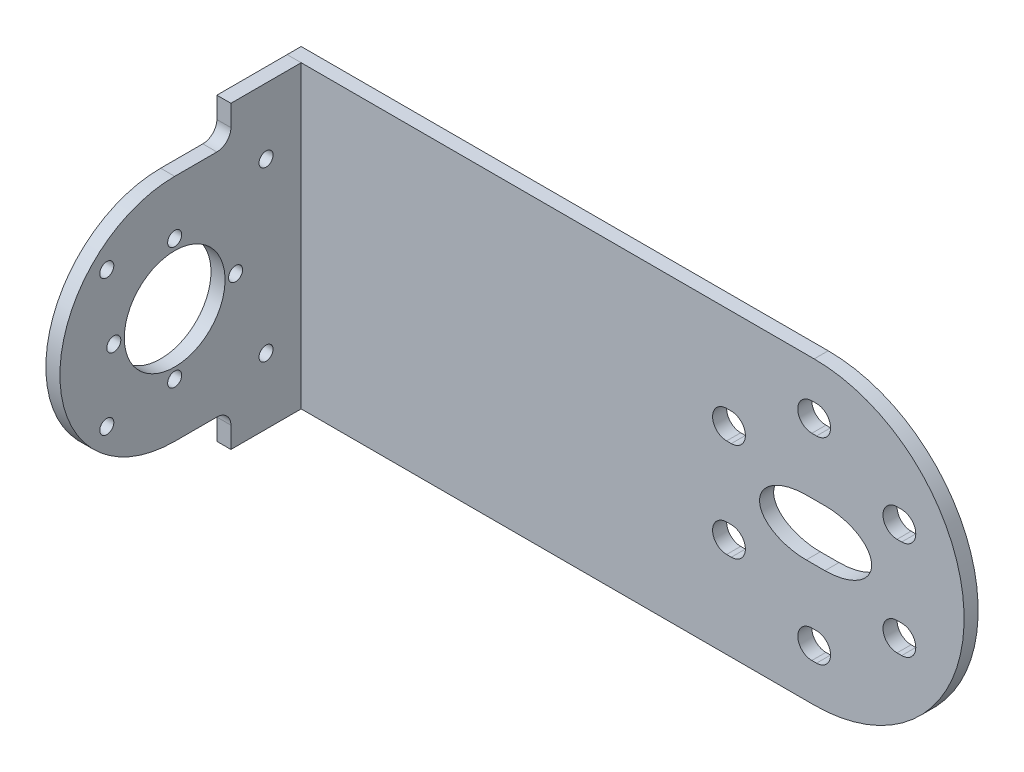
from build123d import *

# Parameters (mm, degrees)
BOSS_EXTRUDE1_DEPTH = 3
SKETCH2_R           = 1.5
BOSS_EXTRUDE2_DEPTH = 3
SKETCH3_R           = 6
CUT_EXTRUDE1_DEPTH  = 150.495916109
CUT_EXTRUDE2_DEPTH  = 128.79866979


with BuildPart() as part:
    # Sketch1 → Boss-Extrude1 (new body)
    with BuildSketch(Plane.XY):
        with BuildLine():
            Line((-112.5, 32), (0, 32))
            ThreePointArc((0, 32), (32, 0), (0, -32))
            Line((0, -32), (-112.5, -32))
            Line((-112.5, -32), (-112.5, 32))
        make_face()
        with BuildLine():
            Line((17.686533479, 13.5), (18.686533479, 13.5))
            ThreePointArc((18.686533479, 13.5), (21.686533479, 10.5), (18.686533479, 7.5))
            Line((18.686533479, 7.5), (17.686533479, 7.5))
            ThreePointArc((17.686533479, 7.5), (14.686533479, 10.5), (17.686533479, 13.5))
        make_face(mode=Mode.SUBTRACT)
        with BuildLine():
            Line((17.686533479, -7.5), (18.686533479, -7.5))
            ThreePointArc((18.686533479, -7.5), (21.686533479, -10.5), (18.686533479, -13.5))
            Line((18.686533479, -13.5), (17.686533479, -13.5))
            ThreePointArc((17.686533479, -13.5), (14.686533479, -10.5), (17.686533479, -7.5))
        make_face(mode=Mode.SUBTRACT)
        with BuildLine():
            Line((-0.5, -18), (0.5, -18))
            ThreePointArc((0.5, -18), (3.5, -21), (0.5, -24))
            Line((0.5, -24), (-0.5, -24))
            ThreePointArc((-0.5, -24), (-3.5, -21), (-0.5, -18))
        make_face(mode=Mode.SUBTRACT)
        with BuildLine():
            Line((-18.686533479, -7.5), (-17.686533479, -7.5))
            ThreePointArc((-17.686533479, -7.5), (-14.686533479, -10.5), (-17.686533479, -13.5))
            Line((-17.686533479, -13.5), (-18.686533479, -13.5))
            ThreePointArc((-18.686533479, -13.5), (-21.686533479, -10.5), (-18.686533479, -7.5))
        make_face(mode=Mode.SUBTRACT)
        with BuildLine():
            Line((-17.686533479, 7.5), (-18.686533479, 7.5))
            ThreePointArc((-18.686533479, 7.5), (-21.686533479, 10.5), (-18.686533479, 13.5))
            Line((-18.686533479, 13.5), (-17.686533479, 13.5))
            ThreePointArc((-17.686533479, 13.5), (-14.686533479, 10.5), (-17.686533479, 7.5))
        make_face(mode=Mode.SUBTRACT)
        with BuildLine():
            Line((0.5, 18), (-0.5, 18))
            ThreePointArc((-0.5, 18), (-3.5, 21), (-0.5, 24))
            Line((-0.5, 24), (0.5, 24))
            ThreePointArc((0.5, 24), (3.5, 21), (0.5, 18))
        make_face(mode=Mode.SUBTRACT)
    extrude(amount=BOSS_EXTRUDE1_DEPTH)

    # Sketch3 → Cut-Extrude1 (cut, through all)
    with BuildSketch(Plane(origin=(-68.399252687, 0, -51.542533886), x_dir=(0, 1, 0), z_dir=(0.798635510047294, 0, 0.6018150231520466))):
        with Locations(Location((0, 1.0136449, 0), (0, 0, 90))):
            Circle(SKETCH3_R)
    extrude(amount=CUT_EXTRUDE1_DEPTH, mode=Mode.SUBTRACT)

    # Sketch4 → Cut-Extrude2 (cut, through all)
    with BuildSketch(Plane.XY.offset(3)):
        with BuildLine():
            Line((2.296821411, -6), (-1.684313054, -6))
            add(Edge.make_bspline(
                [(-1.684313054, 6), (-11.654153901, 6), (-11.654153901, 0), (-11.654153901, -6), (-1.684313054, -6)],
                knots=[4.71238898, 4.71238898, 4.71238898, 6.283185307, 6.283185307, 7.853981634, 7.853981634, 7.853981634], degree=2, weights=[1, 0.707106781, 1, 0.707106781, 1]))
            Line((-1.684313054, 6), (2.296821411, 6))
            add(Edge.make_bspline(
                [(2.296821411, -6), (12.266662258, -6), (12.266662258, 0), (12.266662258, 6), (2.296821411, 6)],
                knots=[4.71238898, 4.71238898, 4.71238898, 6.283185307, 6.283185307, 7.853981634, 7.853981634, 7.853981634], degree=2, weights=[1, 0.707106781, 1, 0.707106781, 1]))
        make_face()
    extrude(amount=-CUT_EXTRUDE2_DEPTH, mode=Mode.SUBTRACT)


with BuildPart() as body_2:
    # Sketch2 → Boss-Extrude2 (new body)
    # profile 1 of 2: a face of its own
    with BuildSketch(Plane.ZY.offset(112.5)):
        with BuildLine():
            Line((3, 0), (3, -32))
            Line((3, -32), (18, -32))
            Line((18, -32), (18, -27.5))
            ThreePointArc((18, -27.5), (18.878679656, -25.378679656), (21, -24.5))
            Line((21, -24.5), (30, -24.5))
            ThreePointArc((30, -24.5), (54.5, 0), (30, 24.5))
            Line((30, 24.5), (21, 24.5))
            ThreePointArc((21, 24.5), (18.878679656, 25.378679656), (18, 27.5))
            Line((18, 27.5), (18, 32))
            Line((18, 32), (3, 32))
            Line((3, 32), (3, 0))
        make_face()
        with Locations((10.5, -17.944358445)):
            Circle(SKETCH2_R, mode=Mode.SUBTRACT)
        with BuildLine():
            ThreePointArc((18.5, 0), (17, -1.5), (15.5, 0))
            ThreePointArc((15.5, 0), (17, 1.5), (18.5, 0))
        make_face(mode=Mode.SUBTRACT)
        with Locations((30, -13)):
            Circle(SKETCH2_R, mode=Mode.SUBTRACT)
        with Locations((44.495689014, -14.495689014)):
            Circle(SKETCH2_R, mode=Mode.SUBTRACT)
        with Locations((10.5, 17.944358445)):
            Circle(SKETCH2_R, mode=Mode.SUBTRACT)
        with BuildLine():
            ThreePointArc((40.75, 0), (30, -10.75), (19.25, 0))
            ThreePointArc((19.25, 0), (30, 10.75), (40.75, 0))
        make_face(mode=Mode.SUBTRACT)
        with Locations((30, 13)):
            Circle(SKETCH2_R, mode=Mode.SUBTRACT)
        with BuildLine():
            ThreePointArc((44.5, 0), (43, -1.5), (41.5, 0))
            ThreePointArc((41.5, 0), (43, 1.5), (44.5, 0))
        make_face(mode=Mode.SUBTRACT)
        with Locations((44.495689014, 14.495689014)):
            Circle(SKETCH2_R, mode=Mode.SUBTRACT)
    # profile 2 of 2: a face of its own
    with BuildSketch(Plane.ZY.offset(112.5)):
        with BuildLine():
            Line((3, 0), (3, -32))
            Line((3, -32), (18, -32))
            Line((18, -32), (18, -27.5))
            ThreePointArc((18, -27.5), (18.878679656, -25.378679656), (21, -24.5))
            Line((21, -24.5), (30, -24.5))
            ThreePointArc((30, -24.5), (54.5, 0), (30, 24.5))
            Line((30, 24.5), (21, 24.5))
            ThreePointArc((21, 24.5), (18.878679656, 25.378679656), (18, 27.5))
            Line((18, 27.5), (18, 32))
            Line((18, 32), (3, 32))
            Line((3, 32), (3, 0))
        make_face()
        with Locations((10.5, -17.944358445)):
            Circle(SKETCH2_R, mode=Mode.SUBTRACT)
        with BuildLine():
            ThreePointArc((18.5, 0), (17, -1.5), (15.5, 0))
            ThreePointArc((15.5, 0), (17, 1.5), (18.5, 0))
        make_face(mode=Mode.SUBTRACT)
        with Locations((30, -13)):
            Circle(SKETCH2_R, mode=Mode.SUBTRACT)
        with Locations((44.495689014, -14.495689014)):
            Circle(SKETCH2_R, mode=Mode.SUBTRACT)
        with Locations((10.5, 17.944358445)):
            Circle(SKETCH2_R, mode=Mode.SUBTRACT)
        with BuildLine():
            ThreePointArc((40.75, 0), (30, -10.75), (19.25, 0))
            ThreePointArc((19.25, 0), (30, 10.75), (40.75, 0))
        make_face(mode=Mode.SUBTRACT)
        with Locations((30, 13)):
            Circle(SKETCH2_R, mode=Mode.SUBTRACT)
        with BuildLine():
            ThreePointArc((44.5, 0), (43, -1.5), (41.5, 0))
            ThreePointArc((41.5, 0), (43, 1.5), (44.5, 0))
        make_face(mode=Mode.SUBTRACT)
        with Locations((44.495689014, 14.495689014)):
            Circle(SKETCH2_R, mode=Mode.SUBTRACT)
    extrude(amount=-BOSS_EXTRUDE2_DEPTH)


solid = Compound([part.part, body_2.part])
